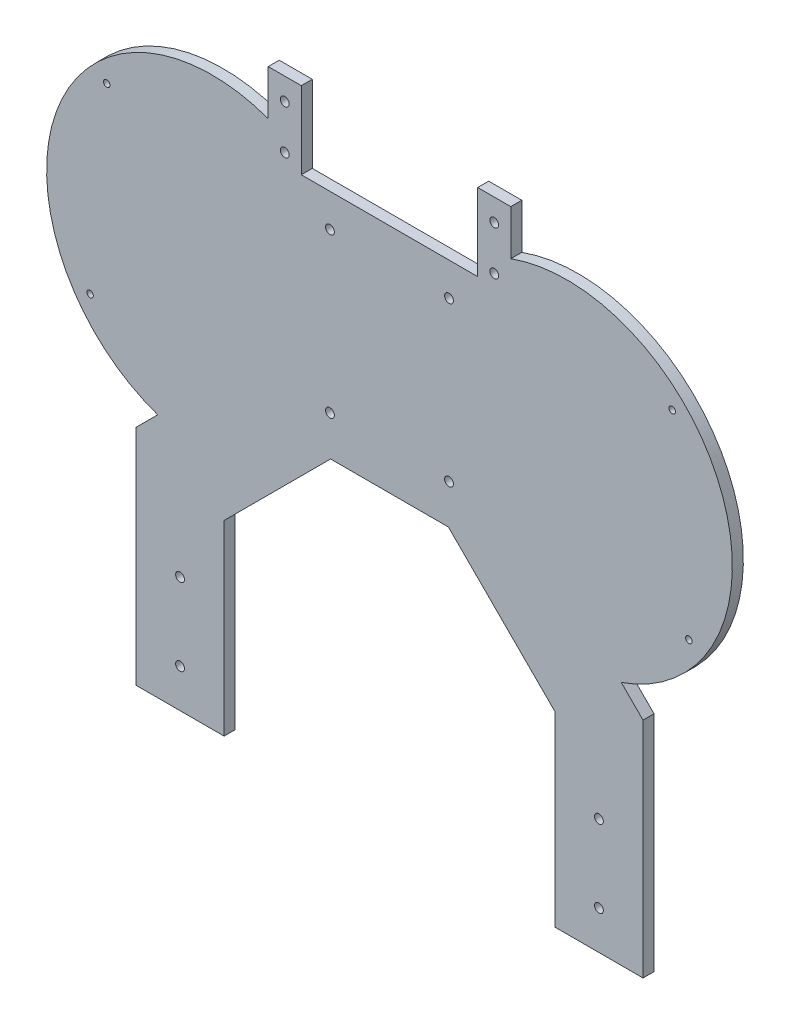
from build123d import *

# Parameters (mm, degrees)
SKETCH1_R           = 2
BOSS_EXTRUDE1_DEPTH = 5
SKETCH2_R           = 2
BOSS_EXTRUDE2_DEPTH = 5
BOSS_EXTRUDE3_START = -5
SKETCH3_R           = 1.4732
SKETCH3_R_2         = 2
BOSS_EXTRUDE3_DEPTH = 5


with BuildPart() as part:
    # Sketch1 → Boss-Extrude1 (new body)
    with BuildSketch(Plane.XY):
        Polygon((-40, 70), (-55, 70), (-55, -70), (55, -70), (55, 70), (40, 70), (40, 35), (-40, 35), align=None)
        with Locations((-27, -52)):
            Circle(SKETCH1_R, mode=Mode.SUBTRACT)
        with Locations((27, -52)):
            Circle(SKETCH1_R, mode=Mode.SUBTRACT)
        with Locations((-27, 20)):
            Circle(SKETCH1_R, mode=Mode.SUBTRACT)
        with Locations((-47.5, 40)):
            Circle(SKETCH1_R, mode=Mode.SUBTRACT)
        with Locations((-47.5, 60)):
            Circle(SKETCH1_R, mode=Mode.SUBTRACT)
        with Locations((27, 20)):
            Circle(SKETCH1_R, mode=Mode.SUBTRACT)
        with Locations((47.5, 40)):
            Circle(SKETCH1_R, mode=Mode.SUBTRACT)
        with Locations((47.5, 60)):
            Circle(SKETCH1_R, mode=Mode.SUBTRACT)
    extrude(amount=BOSS_EXTRUDE1_DEPTH)

    # Sketch2 → Boss-Extrude2 (add)
    with BuildSketch(Plane.XY):
        Polygon((-26.715726767, -70), (-55, -41.715726767), (-115, -101.715728753), (-115, -203), (-75, -203), (-75, -118.284271635), align=None)
        with Locations((-95, -185.5)):
            Circle(SKETCH2_R, mode=Mode.SUBTRACT)
        with Locations((-95, -150.5)):
            Circle(SKETCH2_R, mode=Mode.SUBTRACT)
    boss_extrude2 = extrude(amount=BOSS_EXTRUDE2_DEPTH)

    # Mirror1: Boss-Extrude2 across plane
    add(boss_extrude2.mirror(Plane(origin=(0, 0, 0), x_dir=(0, 0, 1), z_dir=(1, 0, 0))))

    # Sketch3 → Boss-Extrude3 (add)
    # profile 1 of 4: a face of its own
    with BuildSketch(Plane.XY.offset(5).offset(BOSS_EXTRUDE3_START)):
        with BuildLine():
            ThreePointArc((-55, 49.531907673), (-151.188193929, 4.063504127), (-105.126050476, -91.841778902))
            Line((-105.126050476, -91.841778902), (-55, -41.715726767))
            Line((-55, -41.715726767), (-55, 49.531907673))
        make_face()
        with Locations((-135.79276299, -59.716409454)):
            Circle(SKETCH3_R, mode=Mode.SUBTRACT)
        with Locations((-128.22970773, 26.72970773)):
            Circle(SKETCH3_R, mode=Mode.SUBTRACT)
    # profile 2 of 4: a face of its own
    with BuildSketch(Plane.XY.offset(5).offset(BOSS_EXTRUDE3_START)):
        with BuildLine():
            ThreePointArc((-105.126050476, -91.841778902), (-72.958779258, -95.619903442), (-42.197872056, -85.482144776))
            Line((-42.197872056, -85.482144776), (-26.715726767, -70))
            Line((-26.715726767, -70), (-23.719721734, -70))
            ThreePointArc((-23.719721734, -70), (-10.202344029, -47.138851639), (-5.5, -21))
            ThreePointArc((-5.5, -21), (-12.064844908, 9.685982916), (-30.610121267, 35))
            Line((-30.610121267, 35), (-40, 35))
            Line((-40, 35), (-40, 42.124876238))
            ThreePointArc((-40, 42.124876238), (-47.292831667, 46.247929123), (-55, 49.531907673))
            Line((-55, 49.531907673), (-55, -41.715726767))
            Line((-55, -41.715726767), (-105.126050476, -91.841778902))
        make_face()
        with Locations((-27, -52)):
            Circle(SKETCH3_R_2, mode=Mode.SUBTRACT)
        with Locations((-27, 20)):
            Circle(SKETCH3_R_2, mode=Mode.SUBTRACT)
        with Locations((-47.5, 40)):
            Circle(SKETCH3_R_2, mode=Mode.SUBTRACT)
    # profile 3 of 4: a face of its own
    with BuildSketch(Plane.XY.offset(5).offset(BOSS_EXTRUDE3_START)):
        with BuildLine():
            ThreePointArc((30.610121267, 35), (5.660968749, -16.088849276), (23.719721734, -70))
            Line((23.719721734, -70), (26.715726767, -70))
            Line((26.715726767, -70), (42.197872056, -85.482144776))
            ThreePointArc((42.197872056, -85.482144776), (72.958779258, -95.619903442), (105.126050476, -91.841778902))
            Line((105.126050476, -91.841778902), (55, -41.715726767))
            Line((55, -41.715726767), (55, 49.531907673))
            ThreePointArc((55, 49.531907673), (47.292831667, 46.247929123), (40, 42.124876238))
            Line((40, 42.124876238), (40, 35))
            Line((40, 35), (30.610121267, 35))
        make_face()
        with Locations((27, -52)):
            Circle(SKETCH3_R_2, mode=Mode.SUBTRACT)
        with Locations((27, 20)):
            Circle(SKETCH3_R_2, mode=Mode.SUBTRACT)
        with Locations((47.5, 40)):
            Circle(SKETCH3_R_2, mode=Mode.SUBTRACT)
    # profile 4 of 4: a face of its own
    with BuildSketch(Plane.XY.offset(5).offset(BOSS_EXTRUDE3_START)):
        with BuildLine():
            Line((55, -41.715726767), (105.126050476, -91.841778902))
            ThreePointArc((105.126050476, -91.841778902), (141.622638137, -64.462893451), (155.5, -21))
            ThreePointArc((155.5, -21), (123.584219849, 40.390145789), (55, 49.531907673))
            Line((55, 49.531907673), (55, -41.715726767))
        make_face()
        with Locations((135.79276299, -59.716409454)):
            Circle(SKETCH3_R, mode=Mode.SUBTRACT)
        with Locations((128.22970773, 26.72970773)):
            Circle(SKETCH3_R, mode=Mode.SUBTRACT)
    extrude(amount=BOSS_EXTRUDE3_DEPTH)


solid = part.part
